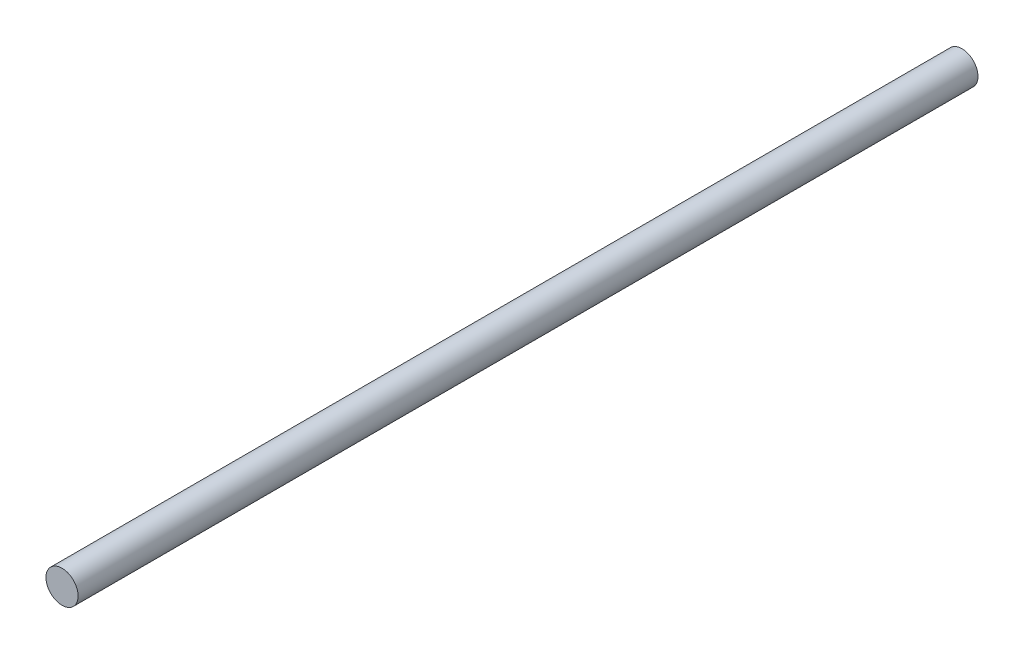
from build123d import *

# Parameters (mm, degrees)
CROQUIS1_R              = 12.5
SALIENTE_EXTRUIR1_DEPTH = 700


with BuildPart() as part:
    # Croquis1 → Saliente-Extruir1 (new body)
    with BuildSketch(Plane.XY):
        Circle(CROQUIS1_R)
    extrude(amount=SALIENTE_EXTRUIR1_DEPTH)


solid = part.part
